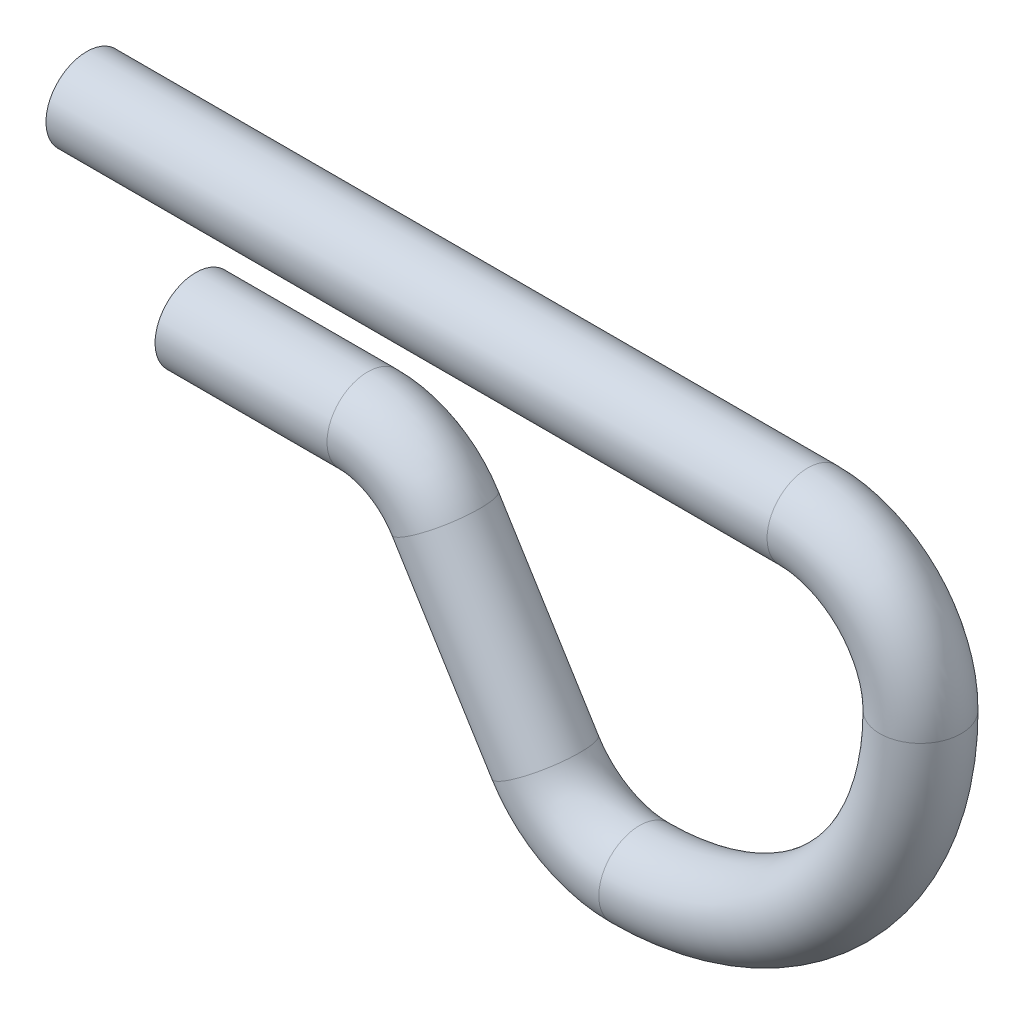
from build123d import *

# Parameters (mm, degrees)
SWEEP1_PROFILE_R = 5.588


with BuildPart() as part:
    # Sweep1: sweep along a path in Sketch1
    with BuildLine(Plane.XY) as sweep1_path:
        Line((0, 0), (23.622, 0))
        ThreePointArc((23.622, 0), (29.714292142, -1.581578377), (34.267947791, -5.92687859))
        Line((34.267947791, -5.92687859), (48.006, -28.09416816))
        ThreePointArc((48.006, -28.09416816), (53.546892782, -33.381533837), (60.96, -35.306))
        ThreePointArc((60.96, -35.306), (88.259978608, -23.997978608), (99.568, 3.302))
        ThreePointArc((99.568, 3.302), (95.029912468, 14.257912468), (84.074, 18.796))
        Line((84.074, 18.796), (-14.986, 18.796))
    # Sweep1 profile (on start of the path) → Sweep1 (sweep)
    with BuildSketch(Plane.YZ):
        Circle(SWEEP1_PROFILE_R)
    sweep(path=sweep1_path.line)


solid = part.part
